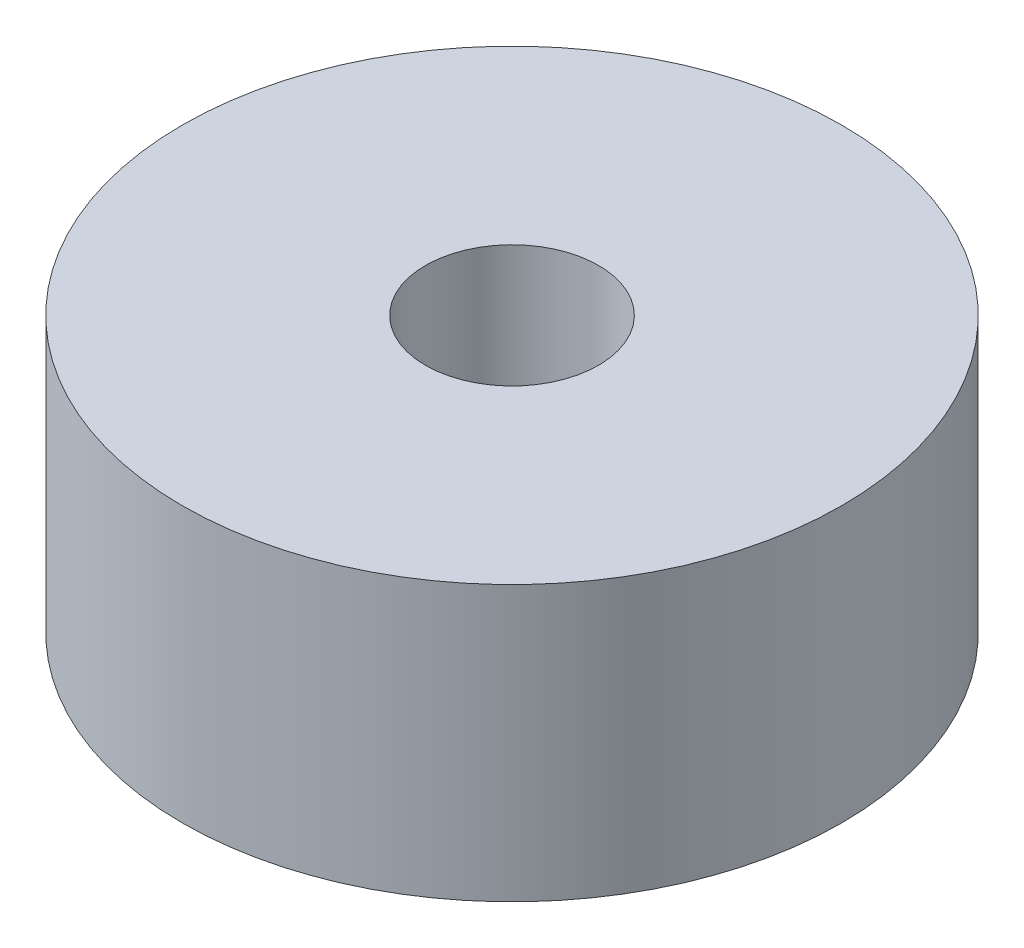
from build123d import *

# Parameters (mm, degrees)
SKETCH1_R           = 3.81
BOSS_EXTRUDE1_DEPTH = 3.175
SKETCH2_R           = 1
CUT_EXTRUDE1_DEPTH  = 3.175


with BuildPart() as part:
    # Sketch1 → Boss-Extrude1 (new body)
    with BuildSketch(Plane(origin=(0, 0, 0), x_dir=(1, 0, 0), z_dir=(0, 1, 0))):
        with Locations(Location((0, 0, 0), (0, 0, 270))):
            Circle(SKETCH1_R)
    extrude(amount=BOSS_EXTRUDE1_DEPTH)

    # Sketch2 → Cut-Extrude1 (cut)
    with BuildSketch(Plane(origin=(0, 3.175, 0), x_dir=(1, 0, 0), z_dir=(0, 1, 0))):
        with Locations(Location((0, 0, 0), (0, 0, 270))):
            Circle(SKETCH2_R)
    extrude(amount=-CUT_EXTRUDE1_DEPTH, mode=Mode.SUBTRACT)


solid = part.part
